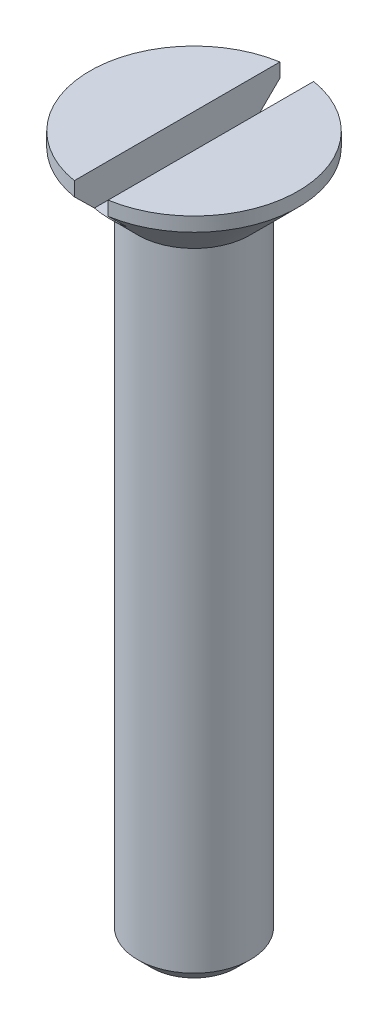
from build123d import *

# Parameters (mm, degrees)
CUT_EXTRUDE_1_DEPTH      = 26.54173056
CUT_EXTRUDE_1_DEPTH_BACK = 26.54173056
SKETCH_2_W               = 1.2
SKETCH_2_H               = 1.2


with BuildPart() as part:
    # Эскиз1 → Повернуть1 (revolve)
    with BuildSketch(Plane.XY):
        Polygon((0, 0), (-1.5, 0), (-2, 0.5), (-2, 22.8), (-3.7, 24.5), (-3.7, 25), (0, 25), align=None)
    revolve(axis=Axis((0, 25, 0), (0, -1, 0)))

    # Эскиз2 → Вырез-Вытянуть1 (cut, two sides: drawn at the far end of the back side and taken through both)
    with BuildSketch(Plane.XY.offset(-CUT_EXTRUDE_1_DEPTH_BACK)):
        with Locations((0, 24.4)):
            Rectangle(SKETCH_2_W, SKETCH_2_H)
    extrude(amount=CUT_EXTRUDE_1_DEPTH + CUT_EXTRUDE_1_DEPTH_BACK, mode=Mode.SUBTRACT)


solid = part.part
